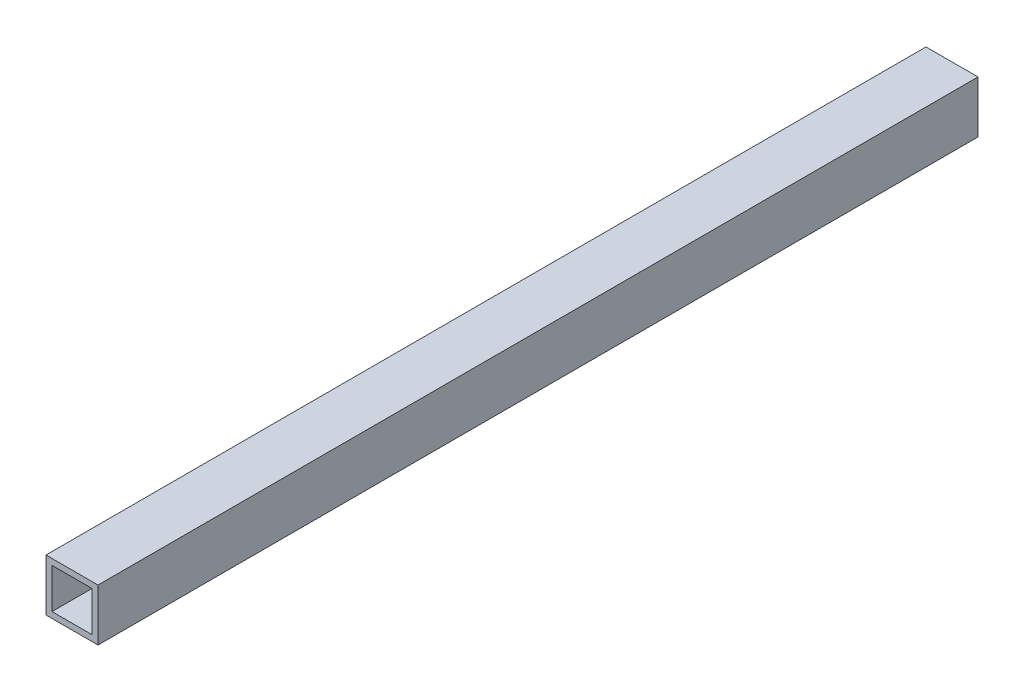
from build123d import *

# Parameters (mm, degrees)
SKETCH1_W           = 13
SKETCH1_H           = 13
SKETCH1_W_2         = 10
SKETCH1_H_2         = 10
BOSS_EXTRUDE1_DEPTH = 220


with BuildPart() as part:
    # Sketch1 → Boss-Extrude1 (new body)
    with BuildSketch(Plane.XY):
        Rectangle(SKETCH1_W, SKETCH1_H)
        Rectangle(SKETCH1_W_2, SKETCH1_H_2, mode=Mode.SUBTRACT)
    extrude(amount=BOSS_EXTRUDE1_DEPTH)


solid = part.part
